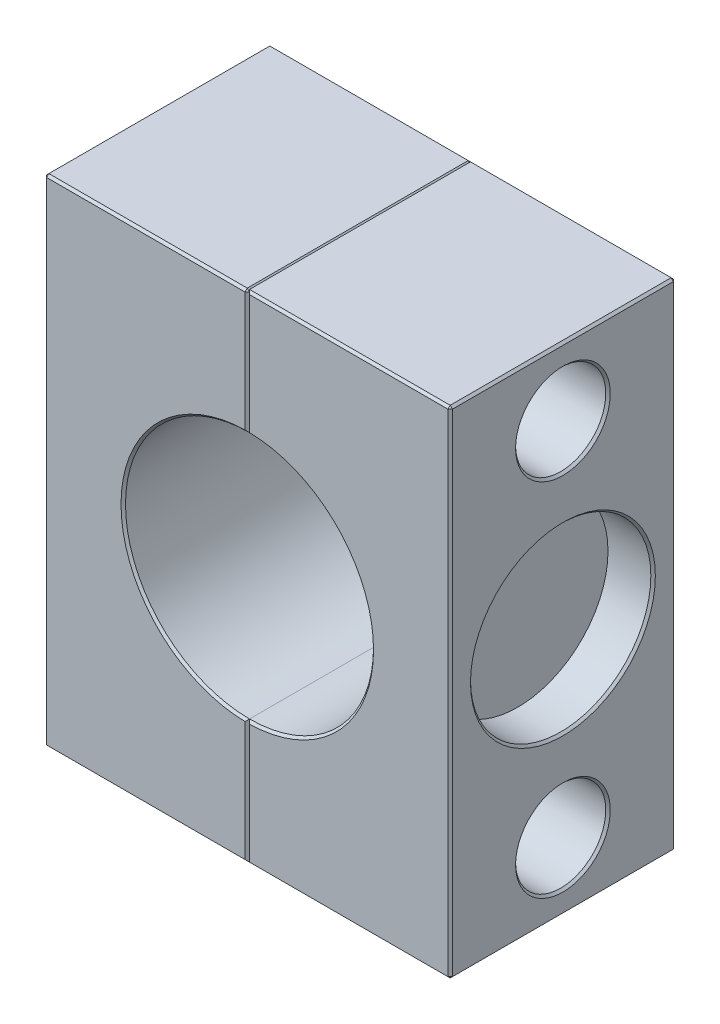
from build123d import *

# Parameters (mm, degrees)
BOSS_EXTRUDE1_DEPTH = 5
BOSS_EXTRUDE2_DEPTH = 5
SKETCH4_R           = 2
CUT_EXTRUDE3_DEPTH  = 22.679483389
SKETCH5_R           = 4
CUT_EXTRUDE4_DEPTH  = 2
CHAMFER1_SIZE       = 0.1
CHAMFER2_SIZE       = 0.1
CHAMFER3_SIZE       = 0.1


with BuildPart() as part:
    # Sketch1 → Boss-Extrude1 (new, symmetric)
    with BuildSketch(Plane.XY):
        with BuildLine():
            Line((0, 5.5), (0, 11))
            Line((0, 11), (-9, 11))
            Line((-9, 11), (-9, -11))
            Line((-9, -11), (0, -11))
            Line((0, -11), (0, -5.5))
            ThreePointArc((0, -5.5), (-5.5, 0), (0, 5.5))
        make_face()
    extrude(amount=BOSS_EXTRUDE1_DEPTH, both=True)


with BuildPart() as body_2:
    # Sketch3 → Boss-Extrude2 (new, symmetric)
    with BuildSketch(Plane.XY):
        with BuildLine():
            Line((9, 11), (0, 11))
            Line((0, 11), (0, 5.5))
            ThreePointArc((0, 5.5), (3.889087297, 3.889087297), (5.5, 0))
            ThreePointArc((5.5, 0), (3.889087297, -3.889087297), (0, -5.5))
            Line((0, -5.5), (0, -11))
            Line((0, -11), (9, -11))
            Line((9, -11), (9, 11))
        make_face()
    extrude(amount=BOSS_EXTRUDE2_DEPTH, both=True)


with BuildPart() as cut_extrude3_tool:
    # Sketch4 → Cut-Extrude3 (new, through all)
    with BuildSketch(Plane(origin=(9, 0, 0), x_dir=(0, 0, -1), z_dir=(1, 0, 0))):
        with Locations((0, 8)):
            Circle(SKETCH4_R)
        with Locations((0, -8)):
            Circle(SKETCH4_R)
    extrude(amount=-CUT_EXTRUDE3_DEPTH)


with BuildPart() as part_1:
    add(part.part)

    # Cut-Extrude3: cut by cut_extrude3_tool
    add(cut_extrude3_tool.part, mode=Mode.SUBTRACT)

    # Chamfer2
    chamfer2_edges = [part_1.edges().sort_by_distance(p)[0] for p in [
        (-5.5, 0, -5),
        (0, 8.25, 5),
        (-9, -11, 0),
        (-9, 11, 0),
        (0, 11, 0),
        (-4.5, 11, 5),
        (-9, 0, 5),
        (-9, 8, 2),
        (-4.5, -11, 5),
        (-9, -8, 2),
        (0, -8.25, 5),
        (-5.5, 0, 5),
        (0, -8.25, -5),
        (-4.5, -11, -5),
        (-9, 0, -5),
        (-4.5, 11, -5),
        (0, 8.25, -5),
    ]]
    chamfer(chamfer2_edges, length=CHAMFER2_SIZE)


with BuildPart() as body_2_1:
    add(body_2.part)

    # Cut-Extrude3: cut by cut_extrude3_tool
    add(cut_extrude3_tool.part, mode=Mode.SUBTRACT)

    # Sketch5 → Cut-Extrude4 (cut)
    with BuildSketch(Plane(origin=(9, 0, 0), x_dir=(0, 0, -1), z_dir=(1, 0, 0))):
        Circle(SKETCH5_R)
    extrude(amount=-CUT_EXTRUDE4_DEPTH, mode=Mode.SUBTRACT)

    # Chamfer1
    chamfer1_edges = [body_2_1.edges().sort_by_distance(p)[0] for p in [
        (5.5, 0, -5),
        (0, -8.25, 5),
        (9, 11, 0),
        (9, -11, 0),
        (4.5, -11, 5),
        (9, 0, 5),
        (4.5, 11, 5),
        (0, 8.25, 5),
        (5.5, 0, 5),
        (0, 8.25, -5),
        (4.5, 11, -5),
        (9, 0, -5),
        (4.5, -11, -5),
        (0, -8.25, -5),
    ]]
    chamfer(chamfer1_edges, length=CHAMFER1_SIZE)

    # Chamfer3
    chamfer3_edges = [body_2_1.edges().sort_by_distance(p)[0] for p in [
        (9, 8, 2),
        (9, -8, 2),
        (9, 0, 4),
    ]]
    chamfer(chamfer3_edges, length=CHAMFER3_SIZE)


solid = Compound([part_1.part, body_2_1.part])
